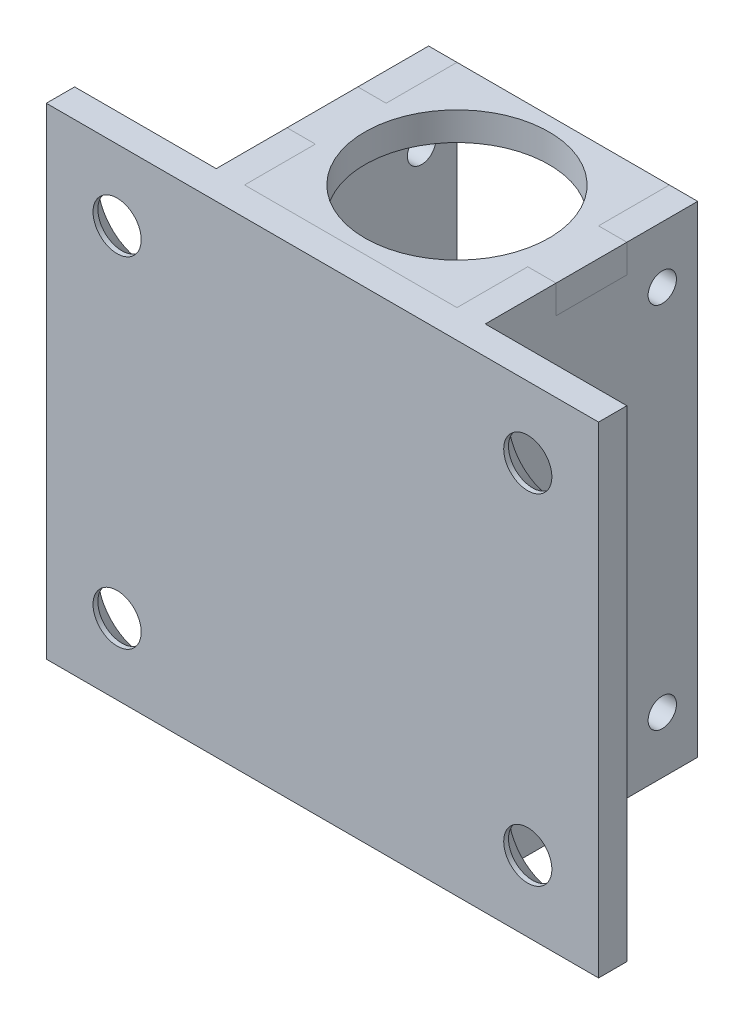
from build123d import *

# Parameters (mm, degrees)
BOSS_EXTRUDE1_DEPTH                                  = 34
SKETCH2_W                                            = 10
SKETCH2_H                                            = 34
BOSS_EXTRUDE2_DEPTH                                  = 2
CSK_FOR_M3_HEX_SOCKET_COUNTERSUNK_CAP_SC_D           = 3.4
CSK_FOR_M3_HEX_SOCKET_COUNTERSUNK_CAP_SC_DEPTH       = 30
CSK_FOR_M3_HEX_SOCKET_COUNTERSUNK_CAP_SC_CSINK_D     = 6.72
CSK_FOR_M3_HEX_SOCKET_COUNTERSUNK_CAP_SC_CSINK_ANGLE = 90
CSK_FOR_M3_HEX_SOCKET_COUNTERSUNK_CAP_SC_TIP         = 1.021463052
SKETCH6_W                                            = 2
SKETCH6_H                                            = 5
CUT_EXTRUDE3_DEPTH                                   = 2
SKETCH6_5_R                                          = 4
BOSS_EXTRUDE5_DEPTH                                  = 2
CUT_EXTRUDE6_DEPTH                                   = 2
SKETCH9_3_R                                          = 6.5
BOSS_EXTRUDE7_DEPTH                                  = 2
SKETCH10_R                                           = 1
CUT_EXTRUDE7_DEPTH                                   = 2


with BuildPart() as part:
    # Sketch1 → Boss-Extrude1 (new body)
    with BuildSketch(Plane(origin=(0, 0, 0), x_dir=(1, 0, 0), z_dir=(0, 1, 0))):
        Polygon((0, 15), (0, 0), (15, 0), (15, 15), (17, 15), (17, -2), (-2, -2), (-2, 15), align=None)
    extrude(amount=BOSS_EXTRUDE1_DEPTH)

    # Sketch2 → Boss-Extrude2 (add)
    with BuildSketch(Plane.XY.offset(2)):
        with Locations((-7, 17)):
            Rectangle(SKETCH2_W, SKETCH2_H)
        with Locations((22, 17)):
            Rectangle(SKETCH2_W, SKETCH2_H)
    extrude(amount=-BOSS_EXTRUDE2_DEPTH)

    # CSK for M3 Hex Socket Countersunk Cap Screw1
    with Locations(Plane(origin=(0, 0, 0), x_dir=(-1, 0, 0), z_dir=(0, 0, -1))):
        with Locations((7, 29), (7, 5), (-22, 5), (-22, 29)):
            CounterSinkHole(CSK_FOR_M3_HEX_SOCKET_COUNTERSUNK_CAP_SC_D / 2, CSK_FOR_M3_HEX_SOCKET_COUNTERSUNK_CAP_SC_CSINK_D / 2, depth=CSK_FOR_M3_HEX_SOCKET_COUNTERSUNK_CAP_SC_DEPTH, counter_sink_angle=CSK_FOR_M3_HEX_SOCKET_COUNTERSUNK_CAP_SC_CSINK_ANGLE)
            with Locations((0, 0, -(CSK_FOR_M3_HEX_SOCKET_COUNTERSUNK_CAP_SC_DEPTH + CSK_FOR_M3_HEX_SOCKET_COUNTERSUNK_CAP_SC_TIP / 2))):  # 118° drill point
                Cone(0, CSK_FOR_M3_HEX_SOCKET_COUNTERSUNK_CAP_SC_D / 2, CSK_FOR_M3_HEX_SOCKET_COUNTERSUNK_CAP_SC_TIP, mode=Mode.SUBTRACT)

    # Sketch6 → Cut-Extrude3 (cut)
    with BuildSketch(Plane.XZ):
        with Locations((-1, -7.5)):
            Rectangle(SKETCH6_W, SKETCH6_H)
        with Locations((16, -7.5)):
            Rectangle(SKETCH6_W, SKETCH6_H)
    extrude(amount=-CUT_EXTRUDE3_DEPTH, mode=Mode.SUBTRACT)

    # Sketch9 → Cut-Extrude6 (cut)
    with BuildSketch(Plane(origin=(0, 34, 0), x_dir=(1, 0, 0), z_dir=(0, 1, 0))):
        Polygon((-2, 10), (-2, 5), (0, 5), (0, 0), (15, 0), (15, 5), (17, 5), (17, 10), (15, 10), (15, 15), (0, 15), (0, 10), align=None)
    extrude(amount=-CUT_EXTRUDE6_DEPTH, mode=Mode.SUBTRACT)

    # Sketch10 → Cut-Extrude7 (cut)
    with BuildSketch(Plane.ZY.offset(2)):
        with Locations((-12.5, 4)):
            Circle(SKETCH10_R)
        with Locations((-12.5, 30)):
            Circle(SKETCH10_R)
        with Locations((-2.5, 30)):
            Circle(SKETCH10_R)
        with Locations((-2.5, 4)):
            Circle(SKETCH10_R)
    cut_extrude7 = extrude(amount=-CUT_EXTRUDE7_DEPTH, mode=Mode.SUBTRACT)

    # Mirror2: Cut-Extrude7 across plane
    add(cut_extrude7.mirror(Plane(origin=(7.5, 0, 0), x_dir=(0, 0, 1), z_dir=(1, 0, 0))), mode=Mode.SUBTRACT)


with BuildPart() as body_2:
    # Sketch6<5> → Boss-Extrude5 (new body)
    with BuildSketch(Plane.XZ):
        Polygon((15, 0), (0, 0), (0, -5), (-2, -5), (-2, -10), (0, -10), (0, -15), (15, -15), (15, -10), (17, -10), (17, -5), (15, -5), align=None)
        with Locations((7.5, -7.5)):
            Circle(SKETCH6_5_R, mode=Mode.SUBTRACT)
    extrude(amount=-BOSS_EXTRUDE5_DEPTH)


with BuildPart() as body_3:
    # Sketch9<3> → Boss-Extrude7 (new body)
    with BuildSketch(Plane(origin=(0, 34, 0), x_dir=(1, 0, 0), z_dir=(0, 1, 0))):
        Polygon((-2, 10), (-2, 5), (0, 5), (0, 0), (15, 0), (15, 5), (17, 5), (17, 10), (15, 10), (15, 15), (0, 15), (0, 10), align=None)
        with Locations((7.5, 7.5)):
            Circle(SKETCH9_3_R, mode=Mode.SUBTRACT)
    extrude(amount=-BOSS_EXTRUDE7_DEPTH)


solid = Compound([part.part, body_2.part, body_3.part])
